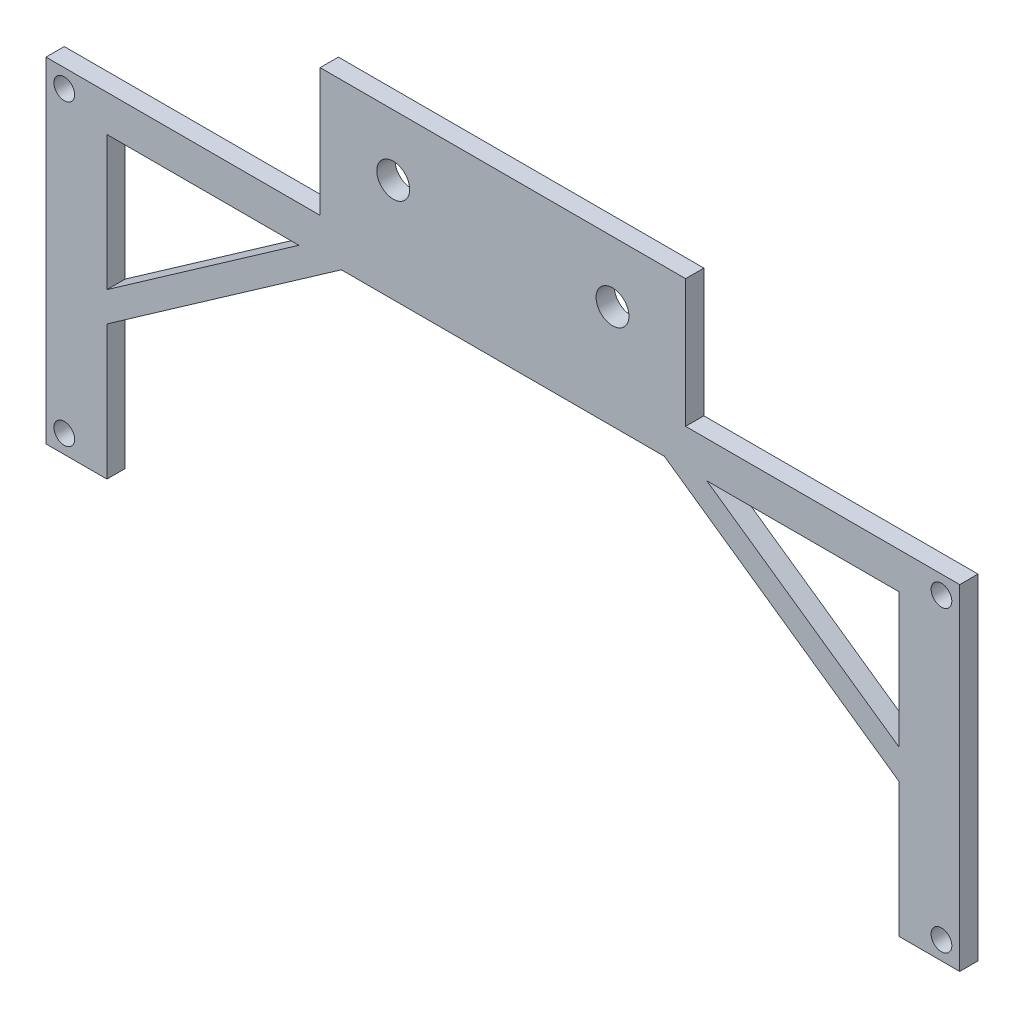
from build123d import *

# Parameters (mm, degrees)
SKETCH_1_W          = 60
SKETCH_1_H          = 27
EXTRUDE_1_DEPTH     = 3
SKETCH_2_W          = 150
SKETCH_2_H          = 6
EXTRUDE_2_DEPTH     = 3
EXTRUDE_3_DEPTH     = 3
SKETCH_4_R          = 1.7
CUT_EXTRUDE_1_DEPTH = 98.67420335
EXTRUDE_4_DEPTH     = 3
SKETCH_6_R          = 2.7
CUT_EXTRUDE_2_DEPTH = 98.67420335


with BuildPart() as part:
    # 草圖1 → 填料-伸長1 (new body)
    with BuildSketch(Plane.XY):
        Rectangle(SKETCH_1_W, SKETCH_1_H)
    extrude(amount=EXTRUDE_1_DEPTH)

    # 草圖2 → 填料-伸長2 (add)
    with BuildSketch(Plane.XY.offset(3)):
        with Locations((0, -10.5)):
            Rectangle(SKETCH_2_W, SKETCH_2_H)
    extrude(amount=-EXTRUDE_2_DEPTH)

    # 草圖3 → 填料-伸長3 (add)
    with BuildSketch(Plane.XY.offset(3)):
        Polygon((65, -62.5), (75, -62.5), (75, -7.5), (-75, -7.5), (-75, -62.5), (-65, -62.5), (-65, -13.5), (65, -13.5), align=None)
    extrude(amount=-EXTRUDE_3_DEPTH)

    # 草圖4 → 除料-伸長1 (cut, through all)
    with BuildSketch(Plane.XY.offset(3)):
        with Locations((-72, -10.5)):
            Circle(SKETCH_4_R)
        with Locations(Location((-72, -59.5, 0), (0, 0, 180))):
            Circle(SKETCH_4_R)
        with Locations((72, -59.5)):
            Circle(SKETCH_4_R)
        with Locations(Location((72, -10.5, 0), (0, 0, 180))):
            Circle(SKETCH_4_R)
    extrude(amount=-CUT_EXTRUDE_1_DEPTH, mode=Mode.SUBTRACT)

    # 草圖5 → 填料-伸長4 (add)
    with BuildSketch(Plane.XY.offset(3)):
        Polygon((-63.853075311, -39.638463841), (-28.853075311, -15.138463841), (-26.512412681, -13.5), (-33.487587319, -13.5), (-65, -35.558688877), (-65, -38), (-65, -40.441311123), align=None)
        Polygon((26.512412681, -13.5), (33.487587319, -13.5), (65, -35.558688877), (65, -38), (65, -40.441311123), (63.853075311, -39.638463841), (28.853075311, -15.138463841), align=None)
    extrude(amount=-EXTRUDE_4_DEPTH)

    # 草圖6 → 除料-伸長2 (cut, through all)
    with BuildSketch(Plane.XY.offset(3)):
        with Locations((-18, 3.5)):
            Circle(SKETCH_6_R)
        with Locations(Location((18, 3.5, 0), (0, 0, 180))):
            Circle(SKETCH_6_R)
    extrude(amount=-CUT_EXTRUDE_2_DEPTH, mode=Mode.SUBTRACT)


solid = part.part
